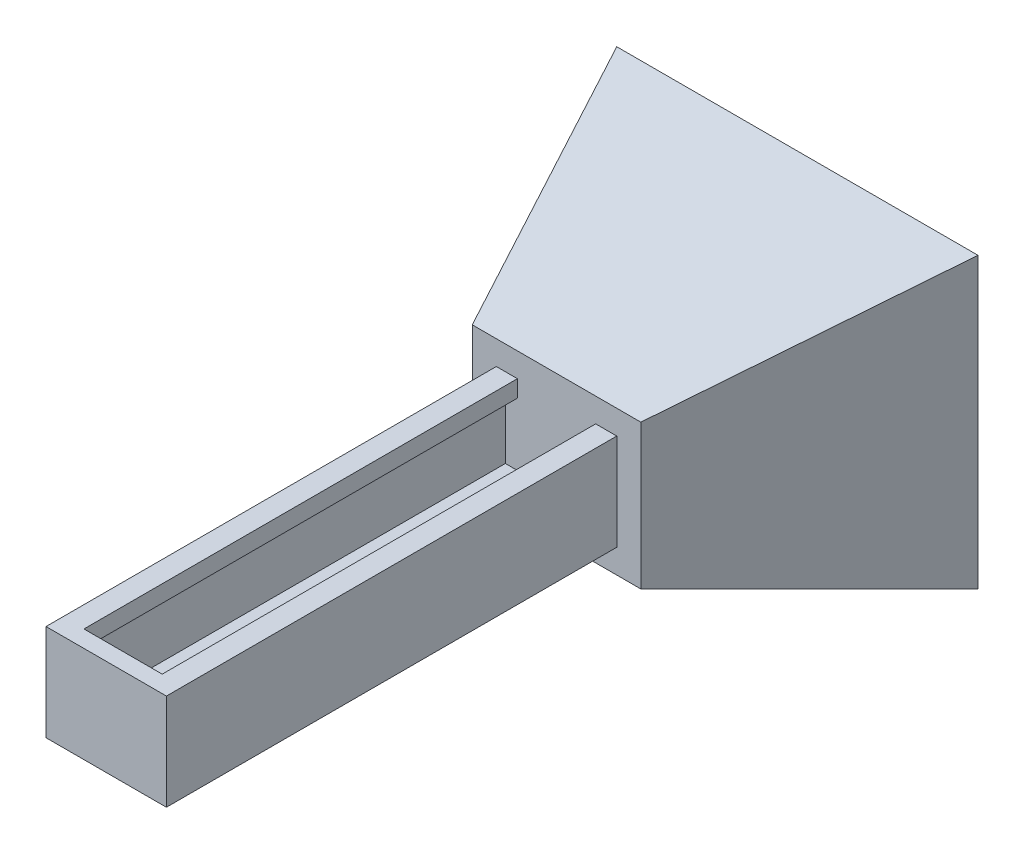
from build123d import *

# Parameters (mm, degrees)
SKETCH2_W           = 750
SKETCH2_H           = 600
BOSS_EXTRUDE1_DEPTH = 500
CUT_EXTRUDE2_DEPTH  = 867.386172558
CUT_EXTRUDE3_DEPTH  = 951
BOSS_EXTRUDE2_DEPTH = 900
SKETCH6_W           = 35
SKETCH6_H           = 200
BOSS_EXTRUDE3_DEPTH = 250


with BuildPart() as part:
    # Sketch2 → Boss-Extrude1 (new body)
    with BuildSketch(Plane.XY):
        Rectangle(SKETCH2_W, SKETCH2_H)
    extrude(amount=-BOSS_EXTRUDE1_DEPTH)

    # Sketch3 → Cut-Extrude2 (cut, through all)
    with BuildSketch(Plane.XZ.offset(300)):
        Polygon((-375, -500), (-375, 0), (-175, 0), align=None)
        Polygon((375, 0), (175, 0), (375, -500), align=None)
    extrude(amount=-CUT_EXTRUDE2_DEPTH, mode=Mode.SUBTRACT)

    # Sketch4 → Cut-Extrude3 (cut, through all)
    with BuildSketch(Plane(origin=(375, 0, 0), x_dir=(0, 0, -1), z_dir=(1, 0, 0))):
        Polygon((500, -300), (0, -300), (0, -150), align=None)
        Polygon((0, 300), (0, 150), (500, 300), align=None)
    extrude(amount=-CUT_EXTRUDE3_DEPTH, mode=Mode.SUBTRACT)

    # Sketch5 → Boss-Extrude2 (add)
    with BuildSketch(Plane.XY):
        Polygon((-81.25, 65), (-81.25, 100), (-125, 100), (-125, -100), (-81.25, -100), (81.25, -100), (125, -100), (125, 100), (81.25, 100), (81.25, 65), (106.25, 65), (106.25, -65), (81.25, -65), (-81.25, -65), (-106.25, -65), (-106.25, 65), align=None)
    extrude(amount=BOSS_EXTRUDE2_DEPTH)

    # Sketch6 → Boss-Extrude3 (add)
    with BuildSketch(Plane(origin=(125, 0, 0), x_dir=(0, 0, -1), z_dir=(1, 0, 0))):
        with Locations((-917.5, 0)):
            Rectangle(SKETCH6_W, SKETCH6_H)
    extrude(amount=-BOSS_EXTRUDE3_DEPTH)


solid = part.part
